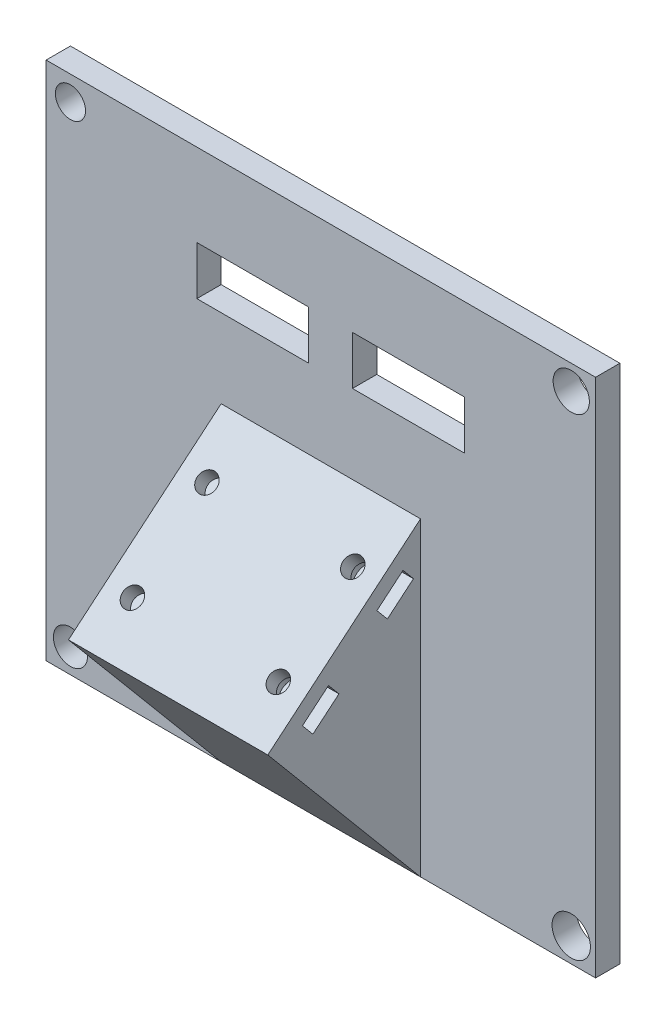
from build123d import *

# Parameters (mm, degrees)
SKETCH1_W           = 113
SKETCH1_H           = 107
BOSS_EXTRUDE1_DEPTH = 20
SKETCH2_W           = 93
SKETCH2_H           = 87
CUT_EXTRUDE1_DEPTH  = 15
BOSS_EXTRUDE4_DEPTH = 20.5
SKETCH7_W           = 23
SKETCH7_H           = 10
CUT_EXTRUDE2_DEPTH  = 41
SKETCH10_R          = 3.727648652
SKETCH10_R_2        = 3.099940234
SKETCH10_R_3        = 3.503081025
SKETCH10_R_4        = 3.946186921
CUT_EXTRUDE3_DEPTH  = 94.259123843
SKETCH12_R          = 2
CUT_EXTRUDE5_DEPTH  = 10
CUT_EXTRUDE6_DEPTH  = 1.675
SKETCH15_W          = 118.362800564
SKETCH15_H          = 111.14113597
CUT_EXTRUDE7_DEPTH  = 86.907098164


with BuildPart() as part:
    # Sketch1 → Boss-Extrude1 (new body)
    with BuildSketch(Plane.XY):
        Rectangle(SKETCH1_W, SKETCH1_H)
    extrude(amount=BOSS_EXTRUDE1_DEPTH)

    # Sketch2 → Cut-Extrude1 (cut)
    with BuildSketch(Plane(origin=(0, 0, 0), x_dir=(-1, 0, 0), z_dir=(0, 0, -1))):
        Rectangle(SKETCH2_W, SKETCH2_H)
    extrude(amount=-CUT_EXTRUDE1_DEPTH, mode=Mode.SUBTRACT)

    # Sketch9 → Boss-Extrude4 (add, symmetric)
    with BuildSketch(Plane.ZY):
        Polygon((20, -53.5), (51.407822168, -16.069615096), (20, 10.284676901), align=None)
    extrude(amount=BOSS_EXTRUDE4_DEPTH, both=True)

    # Sketch7 → Cut-Extrude2 (cut)
    with BuildSketch(Plane(origin=(0, 0, 15), x_dir=(-1, 0, 0), z_dir=(0, 0, -1))):
        with Locations((-18, 31.5)):
            Rectangle(SKETCH7_W, SKETCH7_H)
        with Locations((14, 31.5)):
            Rectangle(SKETCH7_W, SKETCH7_H)
    extrude(amount=-CUT_EXTRUDE2_DEPTH, mode=Mode.SUBTRACT)

    # Sketch10 → Cut-Extrude3 (cut, through all)
    with BuildSketch(Plane(origin=(0, 0, 0), x_dir=(-1, 0, 0), z_dir=(0, 0, -1))):
        with Locations((-51.5, 48.5)):
            Circle(SKETCH10_R)
        with Locations((51.5, 48.5)):
            Circle(SKETCH10_R_2)
        with Locations((51.5, -48.5)):
            Circle(SKETCH10_R_3)
        with Locations((-51.5, -48.5)):
            Circle(SKETCH10_R_4)
    extrude(amount=-CUT_EXTRUDE3_DEPTH, mode=Mode.SUBTRACT)

    # Sketch12 → Cut-Extrude5 (cut)
    with BuildSketch(Plane(origin=(0, 15.883373682, 13.327732998), x_dir=(1, 0, 0), z_dir=(0, 0.7660444431189817, 0.6427876096865348))):
        with Locations(Location((-15, -19.710025981, 0), (0, 0, 270))):
            Circle(SKETCH12_R)
        with Locations(Location((15, -19.710025981, 0), (0, 0, 270))):
            Circle(SKETCH12_R)
        with Locations(Location((-14.999896364, -39.710025981, 0), (0, 0, 270))):
            Circle(SKETCH12_R)
        with Locations(Location((15, -39.710025981, 0), (0, 0, 270))):
            Circle(SKETCH12_R)
    extrude(amount=-CUT_EXTRUDE5_DEPTH, mode=Mode.SUBTRACT)

    # Sketch14 → Cut-Extrude6 (cut, symmetric)
    with BuildSketch(Plane(origin=(0, 12.053151466, 10.11379495), x_dir=(1, 0, 0), z_dir=(0, 0.7660444431189817, 0.6427876096865348))):
        with BuildLine():
            Line((-20.5, -16.210025981), (-20.5, -23.210025981))
            Line((-20.5, -23.210025981), (-15, -23.210025981))
            ThreePointArc((-15, -23.210025981), (-11.5, -19.710025981), (-15, -16.210025981))
            Line((-15, -16.210025981), (-20.5, -16.210025981))
        make_face()
        with BuildLine():
            Line((-20.5, -36.210025981), (-20.5, -43.210025981))
            Line((-20.5, -43.210025981), (-14.999896364, -43.210025981))
            ThreePointArc((-14.999896364, -43.210025981), (-11.499896364, -39.710025981), (-14.999896364, -36.210025981))
            Line((-14.999896364, -36.210025981), (-20.5, -36.210025981))
        make_face()
        with BuildLine():
            Line((20.5, -43.210025981), (20.5, -36.210025981))
            Line((20.5, -36.210025981), (15, -36.210025981))
            ThreePointArc((15, -36.210025981), (11.5, -39.710025981), (15, -43.210025981))
            Line((15, -43.210025981), (20.5, -43.210025981))
        make_face()
        with BuildLine():
            Line((20.5, -23.210025981), (20.5, -16.210025981))
            Line((20.5, -16.210025981), (15, -16.210025981))
            ThreePointArc((15, -16.210025981), (11.5, -19.710025981), (15, -23.210025981))
            Line((15, -23.210025981), (20.5, -23.210025981))
        make_face()
    extrude(amount=CUT_EXTRUDE6_DEPTH, both=True, mode=Mode.SUBTRACT)

    # Sketch15 → Cut-Extrude7 (cut, through all)
    with BuildSketch(Plane(origin=(0, 0, 15), x_dir=(-1, 0, 0), z_dir=(0, 0, -1))):
        Rectangle(SKETCH15_W, SKETCH15_H)
    extrude(amount=CUT_EXTRUDE7_DEPTH, mode=Mode.SUBTRACT)


solid = part.part
